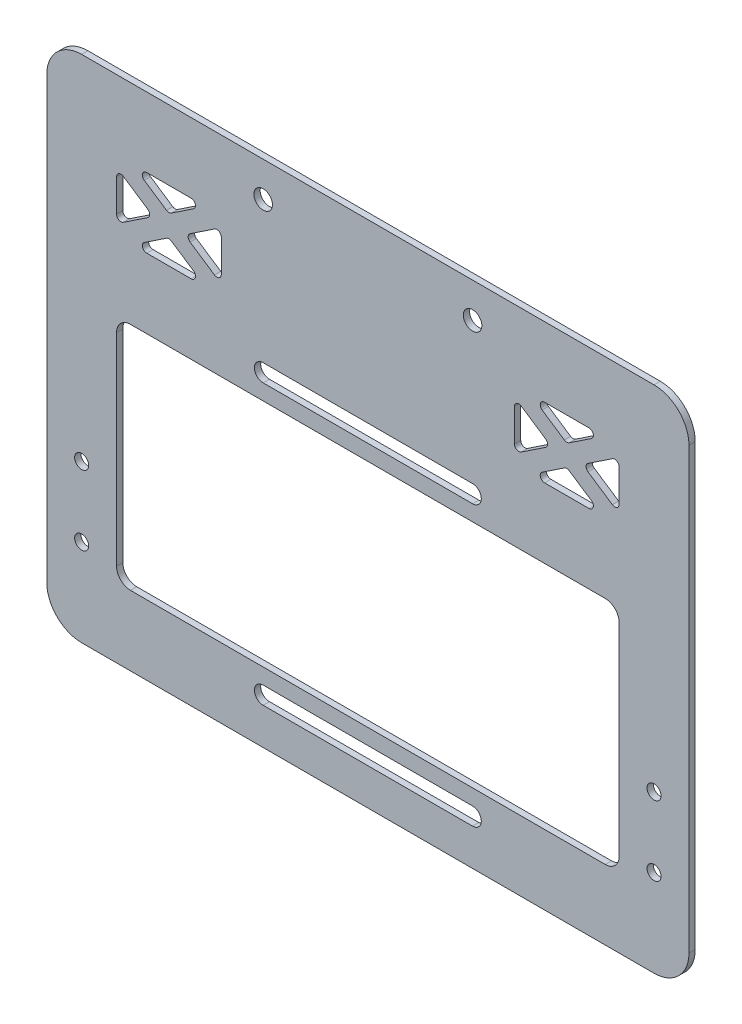
from build123d import *

# Parameters (mm, degrees)
SKETCH1_W               = 233.68
SKETCH1_H               = 185.42
BOSS_EXTRUDE1_DEPTH     = 2.286
CUT_EXTRUDE1_DEPTH      = 150.170893595
F_1_4_CLEARANCE_HOLE2_D = 6.7564
FILLET1_R               = 12.7
SKETCH9_R               = 2.5527
CUT_EXTRUDE2_DEPTH      = 150.170893595
CUT_EXTRUDE3_DEPTH      = 150.170893595
FILLET2_R               = 1.5875


with BuildPart() as part:
    # Sketch1 → Boss-Extrude1 (new body)
    with BuildSketch(Plane.XY):
        Rectangle(SKETCH1_W, SKETCH1_H)
        with BuildLine():
            Line((-86.36, 16.51), (86.36, 16.51))
            ThreePointArc((86.36, 16.51), (89.952102448, 15.022102448), (91.44, 11.43))
            Line((91.44, 11.43), (91.44, -62.23))
            ThreePointArc((91.44, -62.23), (89.952102448, -65.822102448), (86.36, -67.31))
            Line((86.36, -67.31), (-86.36, -67.31))
            ThreePointArc((-86.36, -67.31), (-89.952102448, -65.822102448), (-91.44, -62.23))
            Line((-91.44, -62.23), (-91.44, 11.43))
            ThreePointArc((-91.44, 11.43), (-89.952102448, 15.022102448), (-86.36, 16.51))
        make_face(mode=Mode.SUBTRACT)
    extrude(amount=BOSS_EXTRUDE1_DEPTH)

    # Sketch2 → Cut-Extrude1 (cut, through all)
    with BuildSketch(Plane.XY.offset(2.286)):
        with BuildLine():
            Line((38.1, 22.225), (-38.1, 22.225))
            ThreePointArc((-38.1, 22.225), (-41.275, 25.4), (-38.1, 28.575))
            Line((-38.1, 28.575), (38.1, 28.575))
            ThreePointArc((38.1, 28.575), (41.275, 25.4), (38.1, 22.225))
        make_face()
        with BuildLine():
            Line((38.1, -73.025), (-38.1, -73.025))
            ThreePointArc((-38.1, -73.025), (-41.275, -76.2), (-38.1, -79.375))
            Line((-38.1, -79.375), (38.1, -79.375))
            ThreePointArc((38.1, -79.375), (41.275, -76.2), (38.1, -73.025))
        make_face()
    extrude(amount=-CUT_EXTRUDE1_DEPTH, mode=Mode.SUBTRACT)

    # 1/4 Clearance Hole2 (through all)
    with Locations(Plane.XY.offset(2.286)):
        with Locations((-38.1, 80.01), (38.1, 80.01)):
            Hole(F_1_4_CLEARANCE_HOLE2_D / 2)

    # Fillet1
    fillet1_edges = [part.edges().sort_by_distance(p)[0] for p in [
        (116.84, -92.71, 1.143),
        (-116.84, -92.71, 1.143),
        (-116.84, 92.71, 1.143),
        (116.84, 92.71, 1.143),
    ]]
    fillet(fillet1_edges, radius=FILLET1_R)

    # Sketch9 → Cut-Extrude2 (cut, through all)
    with BuildSketch(Plane.XY.offset(2.286)):
        with Locations((-104.14, -60.96)):
            Circle(SKETCH9_R)
        with Locations((104.14, -60.96)):
            Circle(SKETCH9_R)
        with Locations((104.14, -35.56)):
            Circle(SKETCH9_R)
        with Locations((-104.14, -35.56)):
            Circle(SKETCH9_R)
    extrude(amount=-CUT_EXTRUDE2_DEPTH, mode=Mode.SUBTRACT)

    # Sketch10 → Cut-Extrude3 (cut, through all)
    with BuildSketch(Plane.XY.offset(2.286)):
        Polygon((-59.06381265, 67.31), (-85.71618735, 67.31), (-72.39, 58.4258751), align=None)
        Polygon((-78.11381265, 54.61), (-91.44, 63.4941249), (-91.44, 45.7258751), align=None)
        Polygon((-59.06381265, 41.91), (-72.39, 50.7941249), (-85.71618735, 41.91), align=None)
        Polygon((-53.34, 63.4941249), (-66.66618735, 54.61), (-53.34, 45.7258751), align=None)
        Polygon((85.71618735, 41.91), (72.39, 50.7941249), (59.06381265, 41.91), align=None)
        Polygon((66.66618735, 54.61), (53.34, 63.4941249), (53.34, 45.7258751), align=None)
        Polygon((85.71618735, 67.31), (59.06381265, 67.31), (72.39, 58.4258751), align=None)
        Polygon((91.44, 63.4941249), (78.11381265, 54.61), (91.44, 45.7258751), align=None)
    extrude(amount=-CUT_EXTRUDE3_DEPTH, mode=Mode.SUBTRACT)

    # Fillet2
    fillet2_edges = [part.edges().sort_by_distance(p)[0] for p in [
        (-72.39, 58.4258751, 1.143),
        (-85.71618735, 67.31, 1.143),
        (-59.06381265, 67.31, 1.143),
        (-91.44, 45.7258751, 1.143),
        (-91.44, 63.4941249, 1.143),
        (-78.11381265, 54.61, 1.143),
        (-85.71618735, 41.91, 1.143),
        (-72.39, 50.7941249, 1.143),
        (-59.06381265, 41.91, 1.143),
        (-66.66618735, 54.61, 1.143),
        (-53.34, 63.4941249, 1.143),
        (-53.34, 45.7258751, 1.143),
        (72.39, 50.7941249, 1.143),
        (85.71618735, 41.91, 1.143),
        (59.06381265, 41.91, 1.143),
        (53.34, 45.7258751, 1.143),
        (53.34, 63.4941249, 1.143),
        (66.66618735, 54.61, 1.143),
        (59.06381265, 67.31, 1.143),
        (85.71618735, 67.31, 1.143),
        (72.39, 58.4258751, 1.143),
        (78.11381265, 54.61, 1.143),
        (91.44, 63.4941249, 1.143),
        (91.44, 45.7258751, 1.143),
    ]]
    fillet(fillet2_edges, radius=FILLET2_R)


solid = part.part
